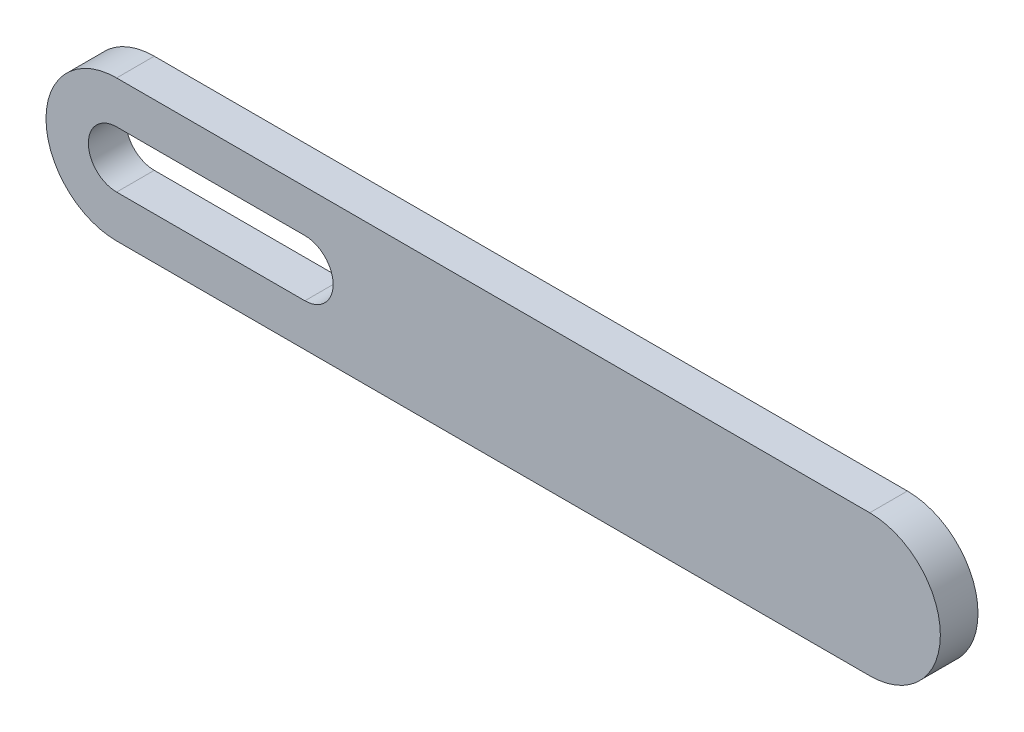
from build123d import *

# Parameters (mm, degrees)
BOSS_EXTRUDE1_DEPTH = 10


with BuildPart() as part:
    # Sketch1 → Boss-Extrude1 (new, symmetric)
    with BuildSketch(Plane.XY):
        with BuildLine():
            Line((0, 37.5), (400, 37.5))
            ThreePointArc((400, 37.5), (437.5, 0), (400, -37.5))
            Line((400, -37.5), (0, -37.5))
            ThreePointArc((0, -37.5), (-37.5, 0), (0, 37.5))
        make_face()
        with BuildLine():
            Line((0, 15), (100, 15))
            ThreePointArc((100, 15), (115, 0), (100, -15))
            Line((100, -15), (0, -15))
            ThreePointArc((0, -15), (-15, 0), (0, 15))
        make_face(mode=Mode.SUBTRACT)
    extrude(amount=BOSS_EXTRUDE1_DEPTH, both=True)


solid = part.part
